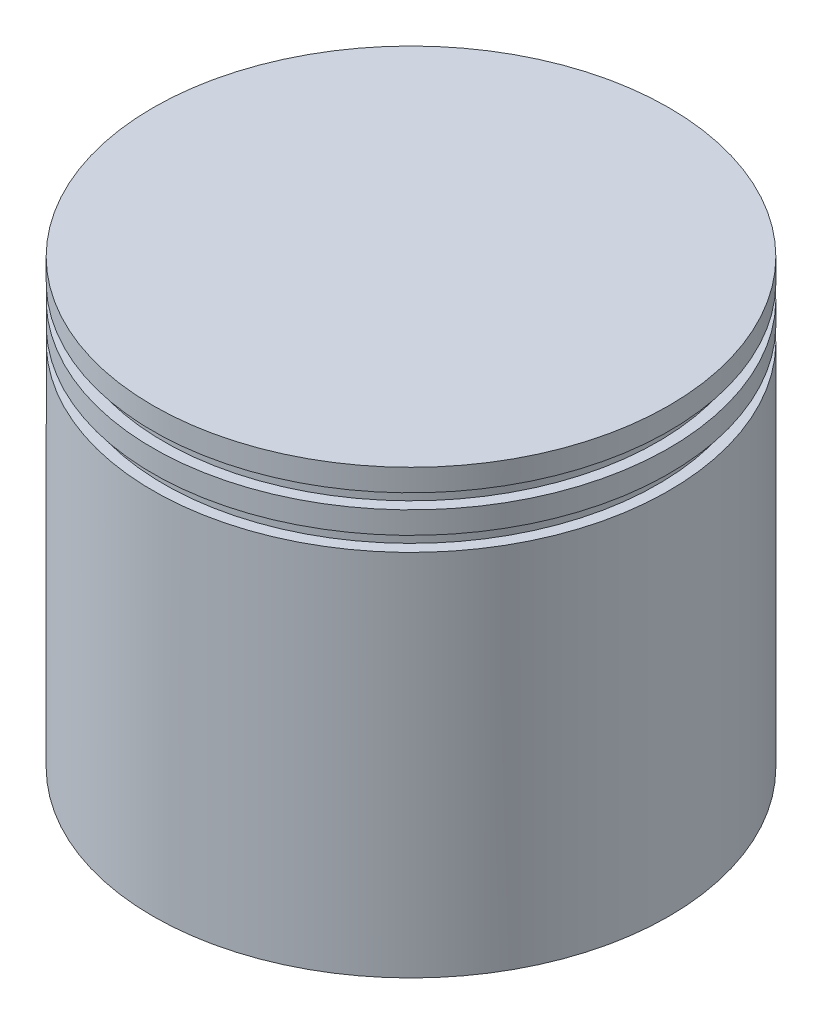
from build123d import *

# Parameters (mm, degrees)
SKETCH_1_R           = 35
EXTRUDE_1_DEPTH      = 60
SHELL_1_T            = -3
SKETCH_2_R           = 3
EXTRUDE_2_DEPTH      = 8
EXTRUDE_3_REACH      = 83.695
EXTRUDE_3_END_RADIUS = 32
SKETCH_3_R           = 6
EXTRUDE_3_DRAFT      = -8
SKETCH_4_W           = 1.5
SKETCH_4_H           = 2


with BuildPart() as part:
    # 草图1 → 拉伸1 (new body)
    with BuildSketch(Plane(origin=(0, 0, 0), x_dir=(1, 0, 0), z_dir=(0, 1, 0))):
        with Locations(Location((0, 0, 0), (0, 0, 270))):
            Circle(SKETCH_1_R)
    extrude(amount=EXTRUDE_1_DEPTH)

    # 抽壳1
    shell_1_openings = [part.faces().sort_by_distance(p)[0] for p in [
        (0, 0, 0),
    ]]
    offset(amount=SHELL_1_T, openings=shell_1_openings, kind=Kind.INTERSECTION)



with BuildPart() as body_2:
    # 草图2 → 拉伸2 (new body)
    with BuildSketch(Plane(origin=(0, 0, 0), x_dir=(0, 0, -1), z_dir=(1, 0, 0))):
        with Locations((0, 15)):
            Circle(SKETCH_2_R)
    extrude_2 = extrude(amount=-EXTRUDE_2_DEPTH)


with BuildPart() as part_1:
    add(part.part)

    add(body_2.part)  # 拉伸3 merges body 2
    # 拉伸3: up to this cylinder (the profile starts inside it)
    extrude_3_end = Plane(origin=(0, 15, 0), z_dir=(0, -1, 0)) * Cylinder(EXTRUDE_3_END_RADIUS, 232.39, mode=Mode.PRIVATE)



with BuildPart() as extrude_3_long_prism_1:
    # 草图3 → 拉伸3 (the long prism of profile 1, to be tilted and cut off)
    with BuildSketch(Plane.ZY.offset(8)):
        with Locations((0, 15)):
            Circle(SKETCH_3_R)
    extrude(amount=EXTRUDE_3_REACH)
    extrude_3_tool1_sides = [extrude_3_long_prism_1.faces().sort_by_distance(p)[0] for p in [
        (-49.8475, 15, -6),
    ]]
    draft(extrude_3_tool1_sides, Plane.ZY.offset(8), EXTRUDE_3_DRAFT)  # the draft: side faces tilted about the start plane


with BuildPart() as part_2:
    add(part_1.part)
    extrude_3_tool1 = extrude_3_long_prism_1.part & extrude_3_end
    extrude_3 = extrude_3_tool1.solids().sort_by_distance((-8, 15, 0))[0]
    add(extrude_3)

    # 镜向1: 拉伸2, 拉伸3 across plane
    add(extrude_2.mirror(Plane(origin=(0, 15, 0), x_dir=(0, 0, 1), z_dir=(1, 0, 0))))
    add(extrude_3.mirror(Plane(origin=(0, 15, 0), x_dir=(0, 0, 1), z_dir=(1, 0, 0))))

    # 草图4 → 切除-旋转1 (revolve, cut)
    with BuildSketch(Plane.XY, mode=Mode.PRIVATE) as cut_revolve_1_sk:
        with Locations((-34.25, 56)):
            Rectangle(SKETCH_4_W, SKETCH_4_H)
        with Locations((-34.25, 51)):
            Rectangle(SKETCH_4_W, SKETCH_4_H)
    revolve(cut_revolve_1_sk.sketch.rotate(Axis((0, 47.542228421, 0), (0, 1, 0)), 270), axis=Axis((0, 47.542228421, 0), (0, 1, 0)), mode=Mode.SUBTRACT)


solid = part_2.part
